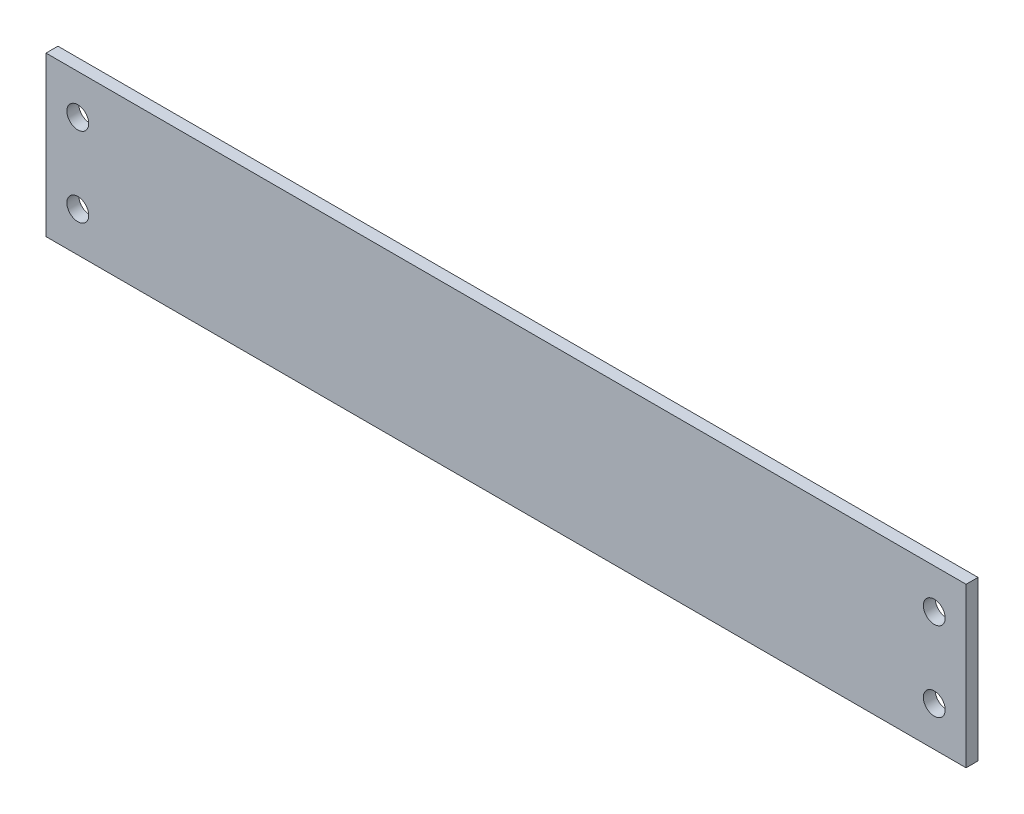
from build123d import *

# Parameters (mm, degrees)
EXTRUSION_BASE_SKETCH_W      = 231.5
EXTRUSION_BASE_SKETCH_H      = 40
EXTRUSION_BASE_EXTRUDE_DEPTH = 3
M5_MOUNTING_HOLES_D          = 5.5


with BuildPart() as part:
    # Extrusion Base Sketch → Extrusion Base Extrude (new body)
    with BuildSketch(Plane.XY):
        with Locations((93.75, 16.75)):
            Rectangle(EXTRUSION_BASE_SKETCH_W, EXTRUSION_BASE_SKETCH_H)
    extrude(amount=-EXTRUSION_BASE_EXTRUDE_DEPTH)

    # M5 Mounting Holes (through all)
    with Locations(Plane(origin=(0, 0, -3), x_dir=(-1, 0, 0), z_dir=(0, 0, -1))):
        with Locations((-201.5, 26.75), (-201.5, 6.75), (14, 26.75), (14, 6.75)):
            Hole(M5_MOUNTING_HOLES_D / 2)


solid = part.part
